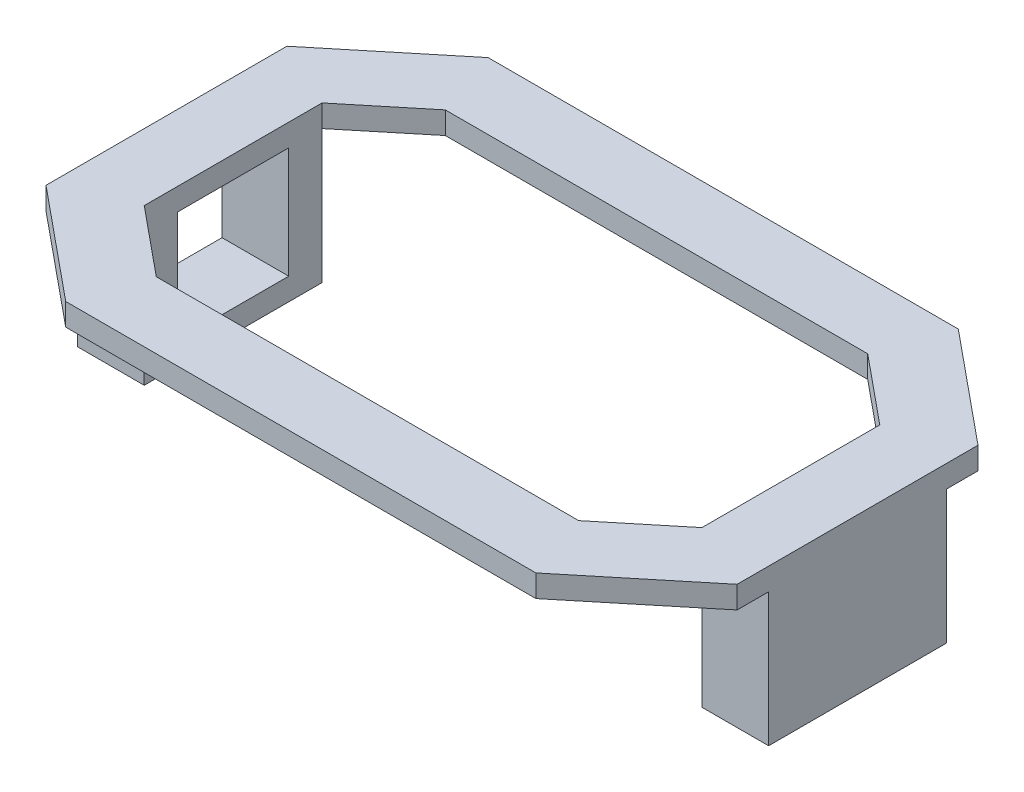
from build123d import *

# Parameters (mm, degrees)
SKETCH1_W             = 15
SKETCH1_H             = 40
SKETCH1_R             = 2
BOSS_EXTRUDE1_DEPTH   = 30
BOSS_EXTRUDE1_2_DEPTH = 30
BOSS_EXTRUDE2_DEPTH   = 5
SKETCH3_W             = 25
SKETCH3_H             = 25
CUT_EXTRUDE1_DEPTH    = 25


with BuildPart() as part:
    # Sketch1 → Boss-Extrude1 (new body)
    with BuildSketch(Plane(origin=(0, 0, 0), x_dir=(1, 0, 0), z_dir=(0, 1, 0))):
        with Locations((7.5, 20)):
            Rectangle(SKETCH1_W, SKETCH1_H)
        with Locations(Location((3.75, 35, 0), (0, 0, 90))):
            Circle(SKETCH1_R, mode=Mode.SUBTRACT)
        with Locations(Location((11.25, 35, 0), (0, 0, 270))):
            Circle(SKETCH1_R, mode=Mode.SUBTRACT)
        with Locations(Location((11.25, 5, 0), (0, 0, 90))):
            Circle(SKETCH1_R, mode=Mode.SUBTRACT)
        with Locations(Location((3.75, 5, 0), (0, 0, 270))):
            Circle(SKETCH1_R, mode=Mode.SUBTRACT)
    extrude(amount=BOSS_EXTRUDE1_DEPTH)



with BuildPart() as body_2:
    # Sketch1 → Boss-Extrude1 2 (new body)
    with BuildSketch(Plane(origin=(0, 0, 0), x_dir=(1, 0, 0), z_dir=(0, 1, 0))):
        with Locations((147.93, 20)):
            Rectangle(SKETCH1_W, SKETCH1_H)
        with Locations(Location((144.18, 5, 0), (0, 0, 270))):
            Circle(SKETCH1_R, mode=Mode.SUBTRACT)
        with Locations(Location((151.68, 5, 0), (0, 0, 90))):
            Circle(SKETCH1_R, mode=Mode.SUBTRACT)
        with Locations(Location((151.68, 35, 0), (0, 0, 270))):
            Circle(SKETCH1_R, mode=Mode.SUBTRACT)
        with Locations(Location((144.18, 35, 0), (0, 0, 90))):
            Circle(SKETCH1_R, mode=Mode.SUBTRACT)
    extrude(amount=BOSS_EXTRUDE1_2_DEPTH)


with BuildPart() as part_1:
    add(part.part)

    add(body_2.part)  # Boss-Extrude2 merges body 2
    # Sketch2 → Boss-Extrude2 (add)
    with BuildSketch(Plane(origin=(0, 30, 0), x_dir=(1, 0, 0), z_dir=(0, 1, 0))):
        Polygon((130.586527376, -27.5), (24.843472624, -27.5), (0, -7.089654433), (0, 47.089654433), (24.843472624, 67.5), (130.586527376, 67.5), (155.43, 47.089654433), (155.43, -7.089654433), align=None)
        Polygon((15, 40), (30.215, 52.5), (125.215, 52.5), (140.43, 40), (140.43, 0), (125.215, -12.5), (30.215, -12.5), (15, 0), align=None, mode=Mode.SUBTRACT)
    extrude(amount=BOSS_EXTRUDE2_DEPTH)

    # Sketch3 → Cut-Extrude1 (cut)
    with BuildSketch(Plane(origin=(15, 0, 0), x_dir=(0, 0, -1), z_dir=(1, 0, 0))):
        with Locations((20, 17.5)):
            Rectangle(SKETCH3_W, SKETCH3_H)
    extrude(amount=-CUT_EXTRUDE1_DEPTH, mode=Mode.SUBTRACT)


solid = part_1.part
